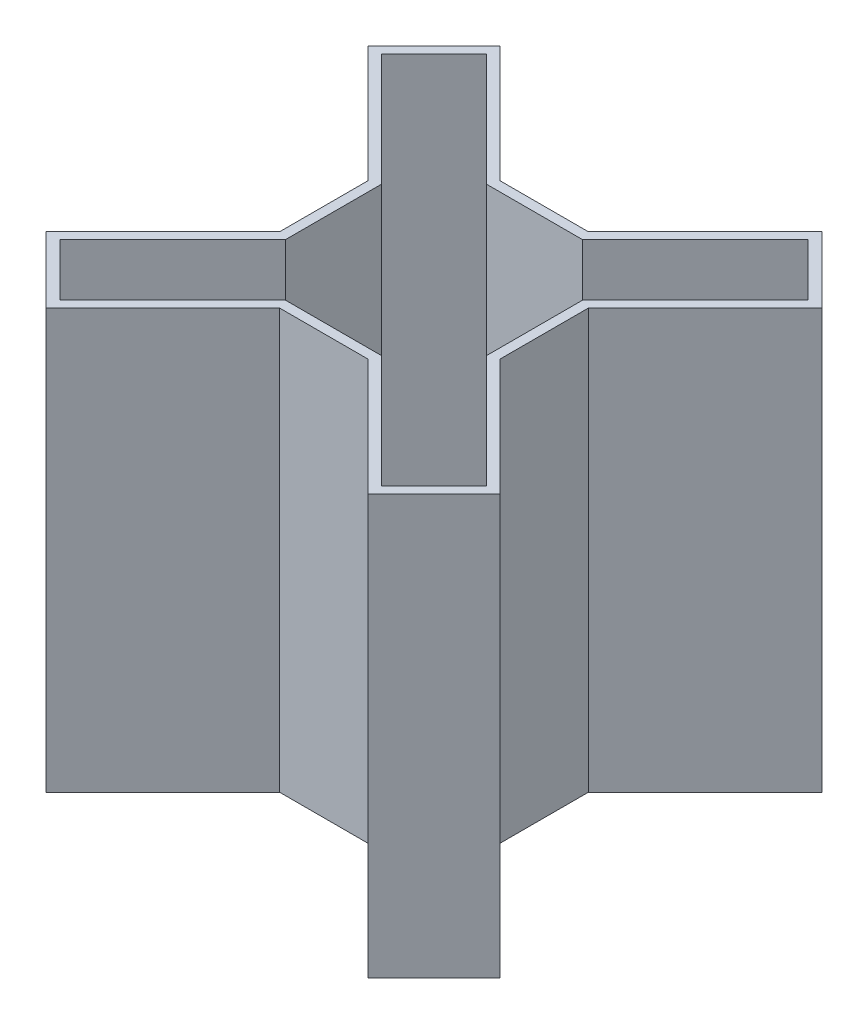
from build123d import *

# Parameters (mm, degrees)
BOSS_EXTRUDE1_DEPTH = 420
BOSS_EXTRUDE2_DEPTH = 10


with BuildPart() as part:
    # Sketch1 → Boss-Extrude1 (new body)
    with BuildSketch(Plane(origin=(0, 0, 0), x_dir=(1, 0, 0), z_dir=(0, 1, 0))):
        Polygon((-113.787540309, 45.905289316), (-233.518909136, 165.636658142), (-165.636658142, 233.518909136), (-45.905289316, 113.787540309), (44.422091789, 113.787540309), (164.153460615, 233.518909136), (232.035711609, 165.636658142), (112.304342783, 45.905289316), (112.304342783, -44.422091789), (232.035711609, -164.153460615), (164.153460615, -232.035711609), (44.422091789, -112.304342783), (-45.905289316, -112.304342783), (-165.636658142, -232.035711609), (-233.518909136, -164.153460615), (-113.787540309, -44.422091789), align=None)
        Polygon((-50.047424939, -102.304342783), (48.564227412, -102.304342783), (164.153460615, -217.893575985), (217.893575985, -164.153460615), (102.304342783, -48.564227412), (102.304342783, 50.047424939), (217.893575985, 165.636658142), (164.153460615, 219.376773512), (48.564227412, 103.787540309), (-50.047424939, 103.787540309), (-165.636658142, 219.376773512), (-219.376773512, 165.636658142), (-103.787540309, 50.047424939), (-103.787540309, -48.564227412), (-219.376773512, -164.153460615), (-165.636658142, -217.893575985), align=None, mode=Mode.SUBTRACT)
    extrude(amount=-BOSS_EXTRUDE1_DEPTH)

    # Sketch3 → Boss-Extrude2 (add)
    with BuildSketch(Plane.XZ.offset(420)):
        Polygon((-113.787540309, 44.422091789), (-113.787540309, -45.905289316), (-233.518909136, -165.636658142), (-165.636658142, -233.518909136), (-45.905289316, -113.787540309), (44.422091789, -113.787540309), (164.153460615, -233.518909136), (232.035711609, -165.636658142), (112.304342783, -45.905289316), (112.304342783, 44.422091789), (232.035711609, 164.153460615), (164.153460615, 232.035711609), (44.422091789, 112.304342783), (-45.905289316, 112.304342783), (-165.636658142, 232.035711609), (-233.518909136, 164.153460615), align=None)
    extrude(amount=BOSS_EXTRUDE2_DEPTH)


solid = part.part
